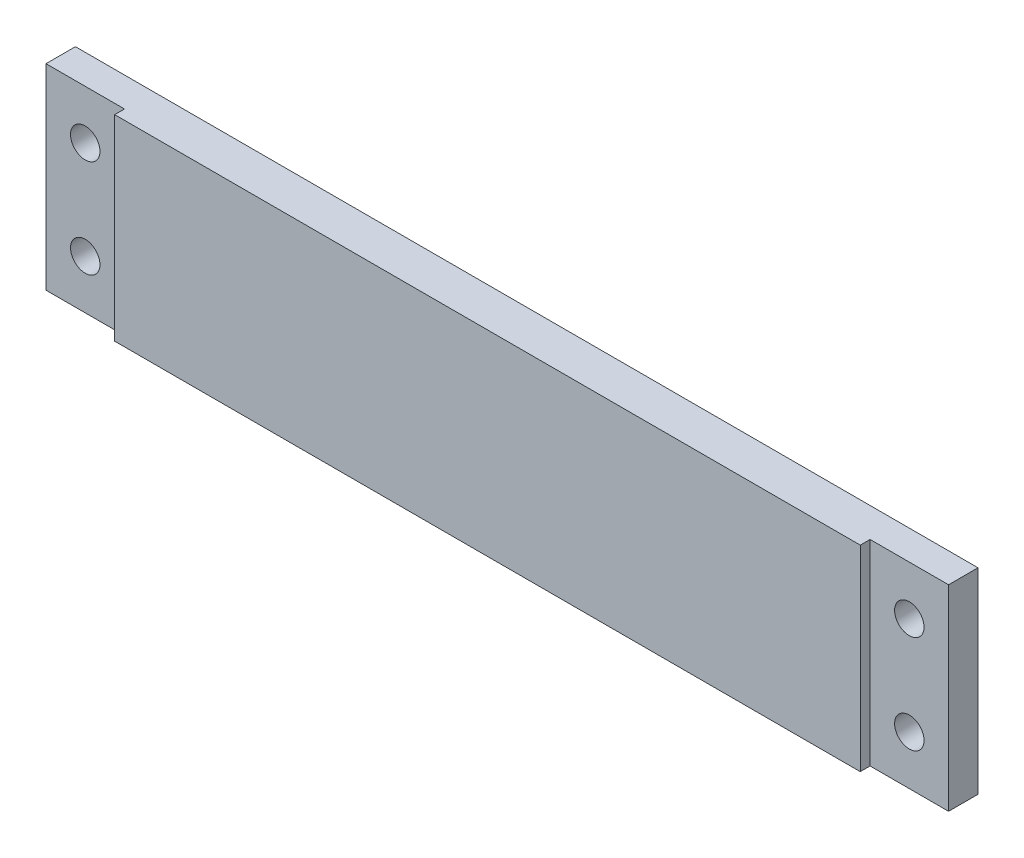
from build123d import *

# Parameters (mm, degrees)
SKETCH1_W           = 92
SKETCH1_H           = 20
SKETCH1_R           = 1.5
BOSS_EXTRUDE1_DEPTH = 4
SKETCH2_W           = 8
SKETCH2_H           = 20
CUT_EXTRUDE1_DEPTH  = 1


with BuildPart() as part:
    # Sketch1 → Boss-Extrude1 (new body)
    with BuildSketch(Plane.XY):
        with Locations((46, 10)):
            Rectangle(SKETCH1_W, SKETCH1_H)
        with Locations((4, 15)):
            Circle(SKETCH1_R, mode=Mode.SUBTRACT)
        with Locations((4, 5)):
            Circle(SKETCH1_R, mode=Mode.SUBTRACT)
        with Locations((88, 5)):
            Circle(SKETCH1_R, mode=Mode.SUBTRACT)
        with Locations((88, 15)):
            Circle(SKETCH1_R, mode=Mode.SUBTRACT)
    extrude(amount=BOSS_EXTRUDE1_DEPTH)

    # Sketch2 → Cut-Extrude1 (cut)
    with BuildSketch(Plane.XY.offset(4)):
        with Locations((4, 10)):
            Rectangle(SKETCH2_W, SKETCH2_H)
        with Locations((88, 10)):
            Rectangle(SKETCH2_W, SKETCH2_H)
    extrude(amount=-CUT_EXTRUDE1_DEPTH, mode=Mode.SUBTRACT)


solid = part.part
